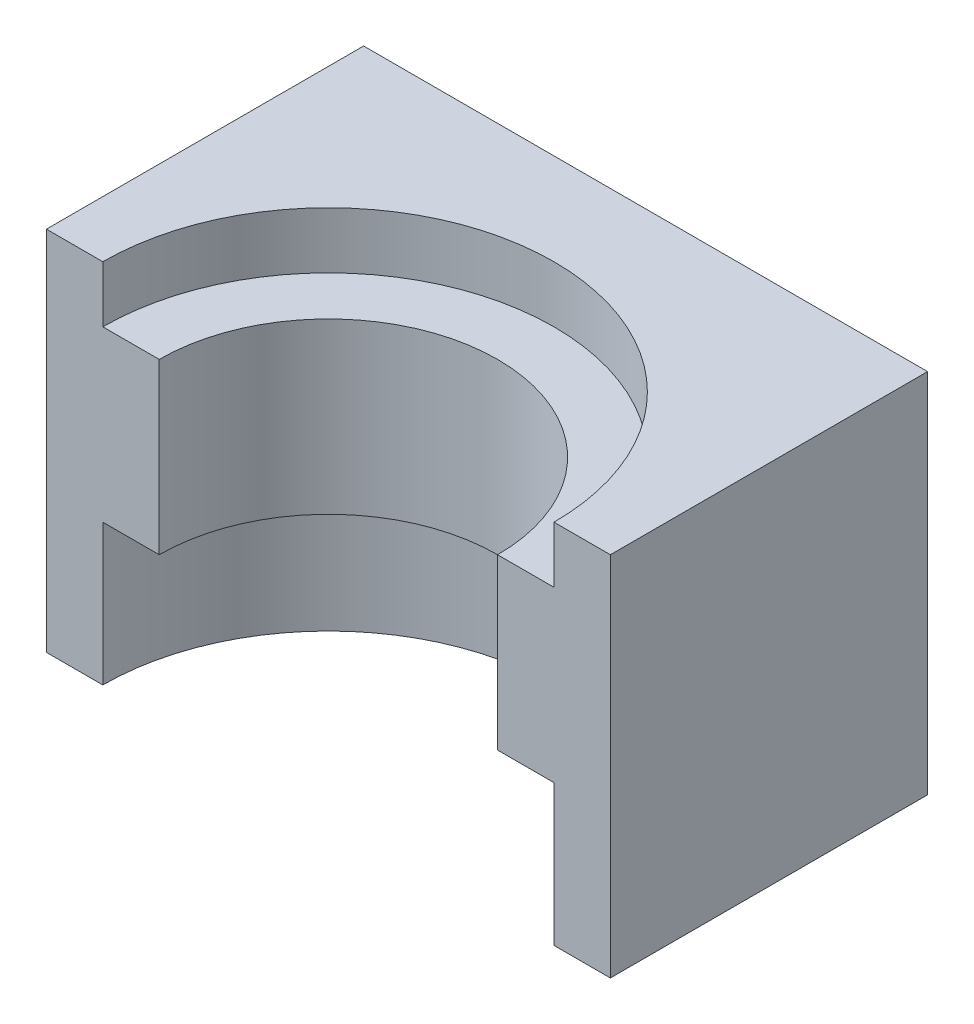
from build123d import *

# Parameters (mm, degrees)
EXTRUDE_1_DEPTH = 5
EXTRUDE_2_DEPTH = 6
EXTRUDE_3_DEPTH = 2


with BuildPart() as part:
    # 草图1 → 凸台-拉伸1 (new body)
    with BuildSketch(Plane(origin=(0, 0, 0), x_dir=(1, 0, 0), z_dir=(0, 1, 0))):
        with BuildLine():
            Line((0, 8.75), (2, 8.75))
            ThreePointArc((2, 8.75), (10, 16.75), (18, 8.75))
            Line((18, 8.75), (20, 8.75))
            Line((20, 8.75), (20, 20))
            Line((20, 20), (0, 20))
            Line((0, 20), (0, 8.75))
        make_face()
    extrude(amount=EXTRUDE_1_DEPTH)

    # 草图2 → 凸台-拉伸2 (add)
    with BuildSketch(Plane(origin=(0, 5, 0), x_dir=(1, 0, 0), z_dir=(0, 1, 0))):
        with BuildLine():
            Line((16, 8.75), (20, 8.75))
            Line((20, 8.75), (20, 20))
            Line((20, 20), (0, 20))
            Line((0, 20), (0, 8.75))
            Line((0, 8.75), (4, 8.75))
            ThreePointArc((4, 8.75), (10, 14.75), (16, 8.75))
        make_face()
    extrude(amount=EXTRUDE_2_DEPTH)

    # 草图3 → 凸台-拉伸3 (add)
    with BuildSketch(Plane(origin=(0, 11, 0), x_dir=(1, 0, 0), z_dir=(0, 1, 0))):
        with BuildLine():
            Line((18, 8.75), (20, 8.75))
            Line((20, 8.75), (20, 20))
            Line((20, 20), (0, 20))
            Line((0, 20), (0, 8.75))
            Line((0, 8.75), (2, 8.75))
            ThreePointArc((2, 8.75), (10, 16.75), (18, 8.75))
        make_face()
    extrude(amount=EXTRUDE_3_DEPTH)


solid = part.part
